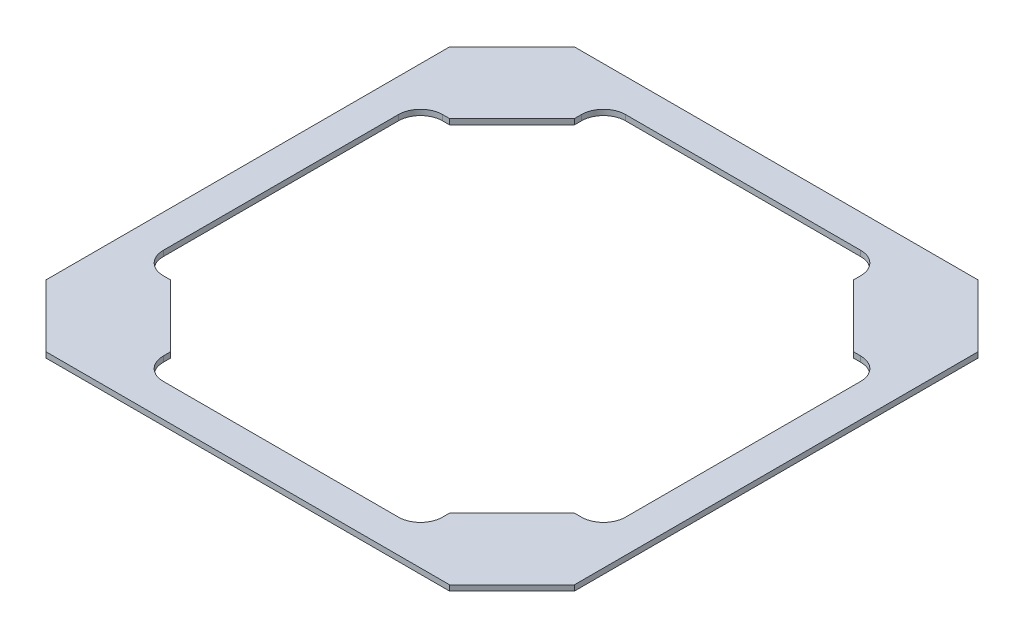
from build123d import *

# Parameters (mm, degrees)
BOSS_EXTRUDE1_DEPTH = 3.175


with BuildPart() as part:
    # Sketch2 → Boss-Extrude1 (new body)
    with BuildSketch(Plane(origin=(0, 0, 0), x_dir=(1, 0, 0), z_dir=(0, 1, 0))):
        Polygon((-152.4, 116.478975516), (-116.478975516, 152.4), (116.478975516, 152.4), (152.4, 116.478975516), (152.4, -116.478975516), (116.478975516, -152.4), (-116.478975516, -152.4), (-152.4, -116.478975516), align=None)
        with BuildLine():
            Line((-116.478975516, 80.557951031), (-80.557951031, 116.478975516))
            Line((-80.557951031, 116.478975516), (-80.557951031, 120.65))
            ThreePointArc((-80.557951031, 120.65), (-76.838207153, 129.630256121), (-67.857951031, 133.35))
            Line((-67.857951031, 133.35), (67.857951031, 133.35))
            ThreePointArc((67.857951031, 133.35), (76.838207153, 129.630256121), (80.557951031, 120.65))
            Line((80.557951031, 120.65), (80.557951031, 116.478975516))
            Line((80.557951031, 116.478975516), (116.478975516, 80.557951031))
            Line((116.478975516, 80.557951031), (120.65, 80.557951031))
            ThreePointArc((120.65, 80.557951031), (129.630256121, 76.838207153), (133.35, 67.857951031))
            Line((133.35, 67.857951031), (133.35, -67.857951031))
            ThreePointArc((133.35, -67.857951031), (129.630256121, -76.838207153), (120.65, -80.557951031))
            Line((120.65, -80.557951031), (116.478975516, -80.557951031))
            Line((116.478975516, -80.557951031), (80.557951031, -116.478975516))
            Line((80.557951031, -116.478975516), (80.557951031, -120.65))
            ThreePointArc((80.557951031, -120.65), (76.838207153, -129.630256121), (67.857951031, -133.35))
            Line((67.857951031, -133.35), (-67.857951031, -133.35))
            ThreePointArc((-67.857951031, -133.35), (-76.838207153, -129.630256121), (-80.557951031, -120.65))
            Line((-80.557951031, -120.65), (-80.557951031, -116.478975516))
            Line((-80.557951031, -116.478975516), (-116.478975516, -80.557951031))
            Line((-116.478975516, -80.557951031), (-120.65, -80.557951031))
            ThreePointArc((-120.65, -80.557951031), (-129.630256121, -76.838207153), (-133.35, -67.857951031))
            Line((-133.35, -67.857951031), (-133.35, 67.857951031))
            ThreePointArc((-133.35, 67.857951031), (-129.630256121, 76.838207153), (-120.65, 80.557951031))
            Line((-120.65, 80.557951031), (-116.478975516, 80.557951031))
        make_face(mode=Mode.SUBTRACT)
    extrude(amount=BOSS_EXTRUDE1_DEPTH)


solid = part.part
